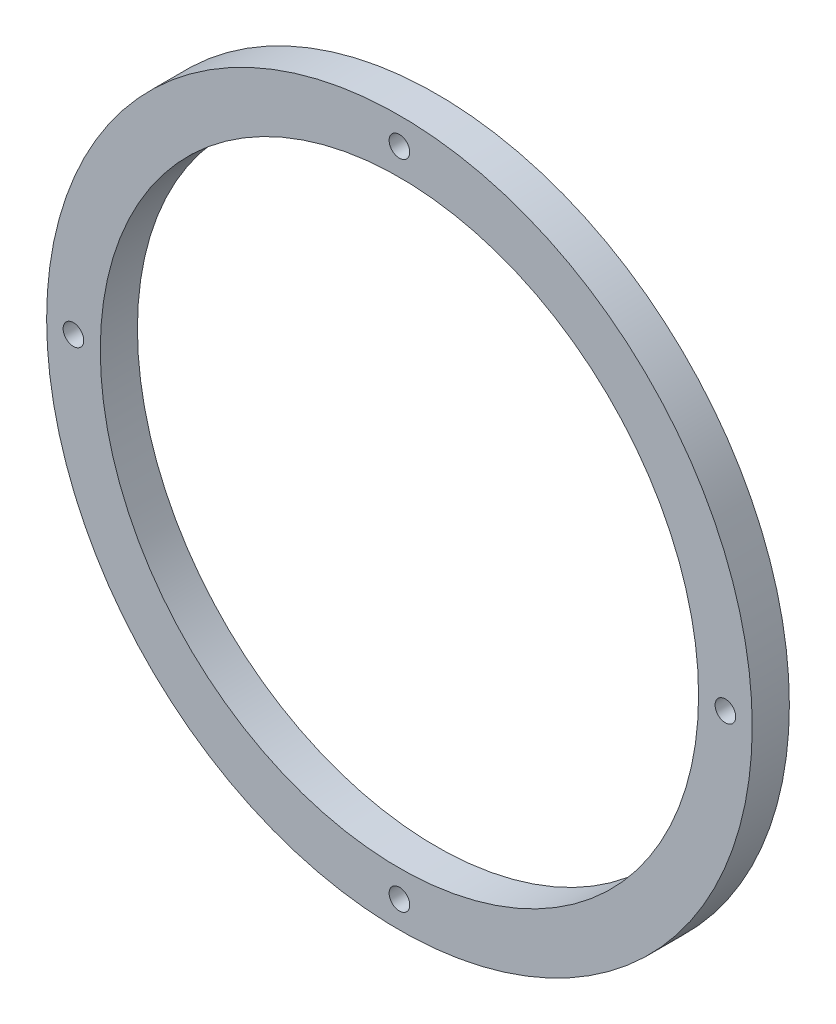
from build123d import *

# Parameters (mm, degrees)
SKETCH_1_R          = 85.5
SKETCH_1_R_2        = 72.5
EXTRUDE_1_DEPTH     = 9
SKETCH_3_R          = 2.5
CUT_EXTRUDE_1_DEPTH = 122.249742268


with BuildPart() as part:
    # 草图1 → 凸台-拉伸1 (new body)
    with BuildSketch(Plane.XY):
        Circle(SKETCH_1_R)
        Circle(SKETCH_1_R_2, mode=Mode.SUBTRACT)
    extrude(amount=EXTRUDE_1_DEPTH)

    # 草图3 → 切除-拉伸1 (cut, through all)
    with BuildSketch(Plane.XY.offset(9)):
        with Locations((0, 79)):
            Circle(SKETCH_3_R)
        with Locations((79, 0)):
            Circle(SKETCH_3_R)
        with Locations((0, -79)):
            Circle(SKETCH_3_R)
        with Locations((-79, 0)):
            Circle(SKETCH_3_R)
    extrude(amount=-CUT_EXTRUDE_1_DEPTH, mode=Mode.SUBTRACT)


solid = part.part
